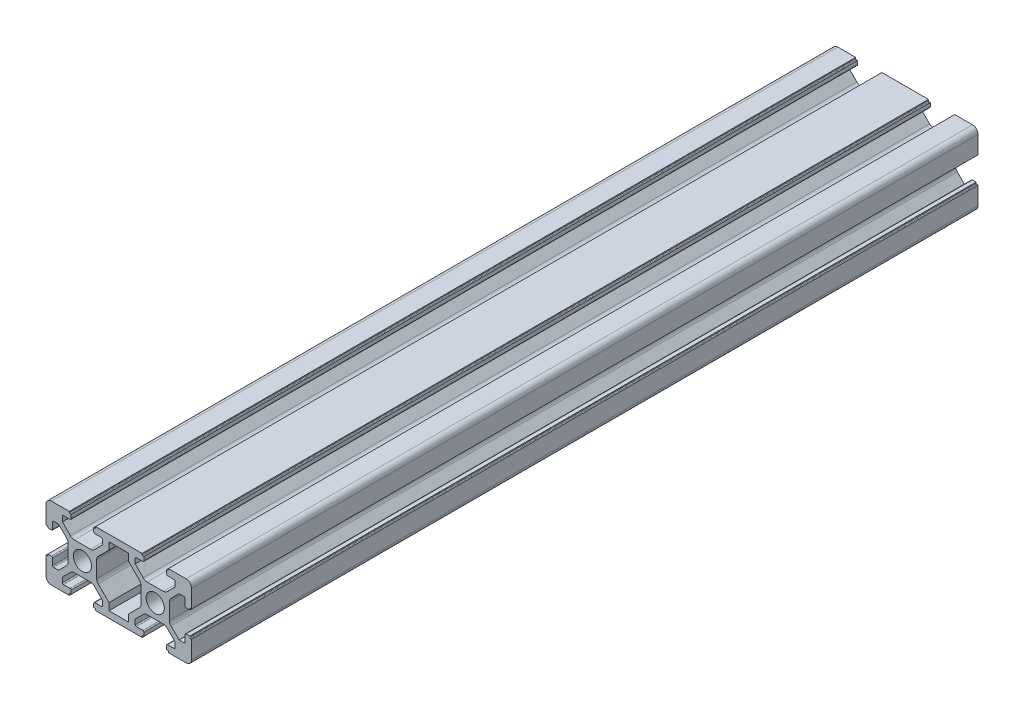
from build123d import *

# Parameters (mm, degrees)
SKETCH_1_R      = 2.5
EXTRUDE_1_DEPTH = 216


with BuildPart() as part:
    # 草图1 → 凸台-拉伸1 (new body)
    with BuildSketch(Plane.XY):
        with BuildLine():
            Line((-0.771587854, 9.545792426), (-5.671587854, 9.545792426))
            Line((-5.671587854, 9.545792426), (-5.671587854, 9.245792426))
            ThreePointArc((-5.671587854, 9.245792426), (-5.730166498, 9.10437107), (-5.871587854, 9.045792426))
            Line((-5.871587854, 9.045792426), (-6.171587854, 9.045792426))
            Line((-6.171587854, 9.045792426), (-6.171587854, 8.045792426))
            ThreePointArc((-6.171587854, 8.045792426), (-6.083719889, 7.833660392), (-5.871587854, 7.745792426))
            Line((-5.871587854, 7.745792426), (-4.071587854, 7.745792426))
            ThreePointArc((-4.071587854, 7.745792426), (-3.85945582, 7.657924461), (-3.771587854, 7.445792426))
            Line((-3.771587854, 7.445792426), (-3.771587854, 6.105792426))
            Line((-3.771587854, 6.105792426), (-5.992248026, 3.885132255))
            ThreePointArc((-5.992248026, 3.885132255), (-6.478883049, 3.559973128), (-7.052908198, 3.445792426))
            Line((-7.052908198, 3.445792426), (-11.490267511, 3.445792426))
            ThreePointArc((-11.490267511, 3.445792426), (-12.064292659, 3.559973128), (-12.550927682, 3.885132255))
            Line((-12.550927682, 3.885132255), (-14.771587854, 6.105792426))
            Line((-14.771587854, 6.105792426), (-14.771587854, 7.445792426))
            ThreePointArc((-14.771587854, 7.445792426), (-14.683719889, 7.657924461), (-14.471587854, 7.745792426))
            Line((-14.471587854, 7.745792426), (-12.671587854, 7.745792426))
            ThreePointArc((-12.671587854, 7.745792426), (-12.45945582, 7.833660392), (-12.371587854, 8.045792426))
            Line((-12.371587854, 8.045792426), (-12.371587854, 9.045792426))
            Line((-12.371587854, 9.045792426), (-12.671587854, 9.045792426))
            ThreePointArc((-12.671587854, 9.045792426), (-12.81300921, 9.10437107), (-12.871587854, 9.245792426))
            Line((-12.871587854, 9.245792426), (-12.871587854, 9.545792426))
            Line((-12.871587854, 9.545792426), (-17.771587854, 9.545792426))
            ThreePointArc((-17.771587854, 9.545792426), (-18.832248026, 9.106452598), (-19.271587854, 8.045792426))
            Line((-19.271587854, 8.045792426), (-19.271587854, 3.145792426))
            Line((-19.271587854, 3.145792426), (-18.971587854, 3.145792426))
            ThreePointArc((-18.971587854, 3.145792426), (-18.830166498, 3.087213783), (-18.771587854, 2.945792426))
            Line((-18.771587854, 2.945792426), (-18.771587854, 2.645792426))
            Line((-18.771587854, 2.645792426), (-17.771587854, 2.645792426))
            ThreePointArc((-17.771587854, 2.645792426), (-17.55945582, 2.733660392), (-17.471587854, 2.945792426))
            Line((-17.471587854, 2.945792426), (-17.471587854, 4.745792426))
            ThreePointArc((-17.471587854, 4.745792426), (-17.383719889, 4.957924461), (-17.171587854, 5.045792426))
            Line((-17.171587854, 5.045792426), (-15.831587854, 5.045792426))
            Line((-15.831587854, 5.045792426), (-13.610927682, 2.825132255))
            ThreePointArc((-13.610927682, 2.825132255), (-13.285768555, 2.338497231), (-13.171587854, 1.764472083))
            Line((-13.171587854, 1.764472083), (-13.171587854, -2.67288723))
            ThreePointArc((-13.171587854, -2.67288723), (-13.285768555, -3.246912379), (-13.610927682, -3.733547402))
            Line((-13.610927682, -3.733547402), (-15.831587854, -5.954207574))
            Line((-15.831587854, -5.954207574), (-17.171587854, -5.954207574))
            ThreePointArc((-17.171587854, -5.954207574), (-17.383719889, -5.866339608), (-17.471587854, -5.654207574))
            Line((-17.471587854, -5.654207574), (-17.471587854, -3.854207574))
            ThreePointArc((-17.471587854, -3.854207574), (-17.55945582, -3.642075539), (-17.771587854, -3.554207574))
            Line((-17.771587854, -3.554207574), (-18.771587854, -3.554207574))
            Line((-18.771587854, -3.554207574), (-18.771587854, -3.854207574))
            ThreePointArc((-18.771587854, -3.854207574), (-18.830166498, -3.99562893), (-18.971587854, -4.054207574))
            Line((-18.971587854, -4.054207574), (-19.271587854, -4.054207574))
            Line((-19.271587854, -4.054207574), (-19.271587854, -8.954207574))
            ThreePointArc((-19.271587854, -8.954207574), (-18.832248026, -10.014867745), (-17.771587854, -10.454207574))
            Line((-17.771587854, -10.454207574), (-12.871587854, -10.454207574))
            Line((-12.871587854, -10.454207574), (-12.871587854, -10.154207574))
            ThreePointArc((-12.871587854, -10.154207574), (-12.81300921, -10.012786217), (-12.671587854, -9.954207574))
            Line((-12.671587854, -9.954207574), (-12.371587854, -9.954207574))
            Line((-12.371587854, -9.954207574), (-12.371587854, -8.954207574))
            ThreePointArc((-12.371587854, -8.954207574), (-12.45945582, -8.742075539), (-12.671587854, -8.654207574))
            Line((-12.671587854, -8.654207574), (-14.471587854, -8.654207574))
            ThreePointArc((-14.471587854, -8.654207574), (-14.683719889, -8.566339608), (-14.771587854, -8.354207574))
            Line((-14.771587854, -8.354207574), (-14.771587854, -7.014207574))
            Line((-14.771587854, -7.014207574), (-12.550927682, -4.793547402))
            ThreePointArc((-12.550927682, -4.793547402), (-12.064292659, -4.468388275), (-11.490267511, -4.354207574))
            Line((-11.490267511, -4.354207574), (-7.052908198, -4.354207574))
            ThreePointArc((-7.052908198, -4.354207574), (-6.478883049, -4.468388275), (-5.992248026, -4.793547402))
            Line((-5.992248026, -4.793547402), (-3.771587854, -7.014207574))
            Line((-3.771587854, -7.014207574), (-3.771587854, -8.354207574))
            ThreePointArc((-3.771587854, -8.354207574), (-3.85945582, -8.566339608), (-4.071587854, -8.654207574))
            Line((-4.071587854, -8.654207574), (-5.871587854, -8.654207574))
            ThreePointArc((-5.871587854, -8.654207574), (-6.083719889, -8.742075539), (-6.171587854, -8.954207574))
            Line((-6.171587854, -8.954207574), (-6.171587854, -9.954207574))
            Line((-6.171587854, -9.954207574), (-5.871587854, -9.954207574))
            ThreePointArc((-5.871587854, -9.954207574), (-5.730166498, -10.012786217), (-5.671587854, -10.154207574))
            Line((-5.671587854, -10.154207574), (-5.671587854, -10.454207574))
            Line((-5.671587854, -10.454207574), (-0.771587854, -10.454207574))
            Line((-0.771587854, -10.454207574), (7.128412146, -10.454207574))
            Line((7.128412146, -10.454207574), (7.128412146, -10.154207574))
            ThreePointArc((7.128412146, -10.154207574), (7.18699079, -10.012786217), (7.328412146, -9.954207574))
            Line((7.328412146, -9.954207574), (7.628412146, -9.954207574))
            Line((7.628412146, -9.954207574), (7.628412146, -8.954207574))
            ThreePointArc((7.628412146, -8.954207574), (7.54054418, -8.742075539), (7.328412146, -8.654207574))
            Line((7.328412146, -8.654207574), (5.528412146, -8.654207574))
            ThreePointArc((5.528412146, -8.654207574), (5.316280111, -8.566339608), (5.228412146, -8.354207574))
            Line((5.228412146, -8.354207574), (5.228412146, -7.014207574))
            Line((5.228412146, -7.014207574), (7.449072318, -4.793547402))
            ThreePointArc((7.449072318, -4.793547402), (7.935707341, -4.468388275), (8.509732489, -4.354207574))
            Line((8.509732489, -4.354207574), (12.947091802, -4.354207574))
            ThreePointArc((12.947091802, -4.354207574), (13.521116951, -4.468388275), (14.007751974, -4.793547402))
            Line((14.007751974, -4.793547402), (16.228412146, -7.014207574))
            Line((16.228412146, -7.014207574), (16.228412146, -8.354207574))
            ThreePointArc((16.228412146, -8.354207574), (16.14054418, -8.566339608), (15.928412146, -8.654207574))
            Line((15.928412146, -8.654207574), (14.128412146, -8.654207574))
            ThreePointArc((14.128412146, -8.654207574), (13.916280111, -8.742075539), (13.828412146, -8.954207574))
            Line((13.828412146, -8.954207574), (13.828412146, -9.954207574))
            Line((13.828412146, -9.954207574), (14.128412146, -9.954207574))
            ThreePointArc((14.128412146, -9.954207574), (14.269833502, -10.012786217), (14.328412146, -10.154207574))
            Line((14.328412146, -10.154207574), (14.328412146, -10.454207574))
            Line((14.328412146, -10.454207574), (19.228412146, -10.454207574))
            ThreePointArc((19.228412146, -10.454207574), (20.289072318, -10.014867745), (20.728412146, -8.954207574))
            Line((20.728412146, -8.954207574), (20.728412146, -4.054207574))
            Line((20.728412146, -4.054207574), (20.428412146, -4.054207574))
            ThreePointArc((20.428412146, -4.054207574), (20.28699079, -3.99562893), (20.228412146, -3.854207574))
            Line((20.228412146, -3.854207574), (20.228412146, -3.554207574))
            Line((20.228412146, -3.554207574), (19.228412146, -3.554207574))
            ThreePointArc((19.228412146, -3.554207574), (19.016280111, -3.642075539), (18.928412146, -3.854207574))
            Line((18.928412146, -3.854207574), (18.928412146, -5.654207574))
            ThreePointArc((18.928412146, -5.654207574), (18.84054418, -5.866339608), (18.628412146, -5.954207574))
            Line((18.628412146, -5.954207574), (17.288412146, -5.954207574))
            Line((17.288412146, -5.954207574), (15.067751974, -3.733547402))
            ThreePointArc((15.067751974, -3.733547402), (14.742592847, -3.246912379), (14.628412146, -2.67288723))
            Line((14.628412146, -2.67288723), (14.628412146, 1.764472083))
            ThreePointArc((14.628412146, 1.764472083), (14.742592847, 2.338497231), (15.067751974, 2.825132255))
            Line((15.067751974, 2.825132255), (17.288412146, 5.045792426))
            Line((17.288412146, 5.045792426), (18.628412146, 5.045792426))
            ThreePointArc((18.628412146, 5.045792426), (18.84054418, 4.957924461), (18.928412146, 4.745792426))
            Line((18.928412146, 4.745792426), (18.928412146, 2.945792426))
            ThreePointArc((18.928412146, 2.945792426), (19.016280111, 2.733660392), (19.228412146, 2.645792426))
            Line((19.228412146, 2.645792426), (20.228412146, 2.645792426))
            Line((20.228412146, 2.645792426), (20.228412146, 2.945792426))
            ThreePointArc((20.228412146, 2.945792426), (20.28699079, 3.087213783), (20.428412146, 3.145792426))
            Line((20.428412146, 3.145792426), (20.728412146, 3.145792426))
            Line((20.728412146, 3.145792426), (20.728412146, 8.045792426))
            ThreePointArc((20.728412146, 8.045792426), (20.289072318, 9.106452598), (19.228412146, 9.545792426))
            Line((19.228412146, 9.545792426), (14.328412146, 9.545792426))
            Line((14.328412146, 9.545792426), (14.328412146, 9.245792426))
            ThreePointArc((14.328412146, 9.245792426), (14.269833502, 9.10437107), (14.128412146, 9.045792426))
            Line((14.128412146, 9.045792426), (13.828412146, 9.045792426))
            Line((13.828412146, 9.045792426), (13.828412146, 8.045792426))
            ThreePointArc((13.828412146, 8.045792426), (13.916280111, 7.833660392), (14.128412146, 7.745792426))
            Line((14.128412146, 7.745792426), (15.928412146, 7.745792426))
            ThreePointArc((15.928412146, 7.745792426), (16.14054418, 7.657924461), (16.228412146, 7.445792426))
            Line((16.228412146, 7.445792426), (16.228412146, 6.105792426))
            Line((16.228412146, 6.105792426), (14.007751974, 3.885132255))
            ThreePointArc((14.007751974, 3.885132255), (13.521116951, 3.559973128), (12.947091802, 3.445792426))
            Line((12.947091802, 3.445792426), (8.509732489, 3.445792426))
            ThreePointArc((8.509732489, 3.445792426), (7.935707341, 3.559973128), (7.449072318, 3.885132255))
            Line((7.449072318, 3.885132255), (5.228412146, 6.105792426))
            Line((5.228412146, 6.105792426), (5.228412146, 7.445792426))
            ThreePointArc((5.228412146, 7.445792426), (5.316280111, 7.657924461), (5.528412146, 7.745792426))
            Line((5.528412146, 7.745792426), (7.328412146, 7.745792426))
            ThreePointArc((7.328412146, 7.745792426), (7.54054418, 7.833660392), (7.628412146, 8.045792426))
            Line((7.628412146, 8.045792426), (7.628412146, 9.045792426))
            Line((7.628412146, 9.045792426), (7.328412146, 9.045792426))
            ThreePointArc((7.328412146, 9.045792426), (7.18699079, 9.10437107), (7.128412146, 9.245792426))
            Line((7.128412146, 9.245792426), (7.128412146, 9.545792426))
            Line((7.128412146, 9.545792426), (2.228412146, 9.545792426))
            Line((2.228412146, 9.545792426), (-0.771587854, 9.545792426))
        make_face()
        with Locations((10.728412146, -0.454207574)):
            Circle(SKETCH_1_R, mode=Mode.SUBTRACT)
        with Locations((-9.271587854, -0.454207574)):
            Circle(SKETCH_1_R, mode=Mode.SUBTRACT)
        with BuildLine():
            Line((-1.971587854, -6.694207574), (-4.932248026, -3.733547402))
            ThreePointArc((-4.932248026, -3.733547402), (-5.257407153, -3.246912379), (-5.371587854, -2.67288723))
            Line((-5.371587854, -2.67288723), (-5.371587854, 1.764472083))
            ThreePointArc((-5.371587854, 1.764472083), (-5.257407153, 2.338497231), (-4.932248026, 2.825132255))
            Line((-4.932248026, 2.825132255), (-1.971587854, 5.785792426))
            Line((-1.971587854, 5.785792426), (-1.971587854, 7.745792426))
            Line((-1.971587854, 7.745792426), (3.428412146, 7.745792426))
            Line((3.428412146, 7.745792426), (3.428412146, 5.785792426))
            Line((3.428412146, 5.785792426), (6.389072318, 2.825132255))
            ThreePointArc((6.389072318, 2.825132255), (6.714231445, 2.338497231), (6.828412146, 1.764472083))
            Line((6.828412146, 1.764472083), (6.828412146, -2.67288723))
            ThreePointArc((6.828412146, -2.67288723), (6.714231445, -3.246912379), (6.389072318, -3.733547402))
            Line((6.389072318, -3.733547402), (3.428412146, -6.694207574))
            Line((3.428412146, -6.694207574), (3.428412146, -8.654207574))
            Line((3.428412146, -8.654207574), (-1.971587854, -8.654207574))
            Line((-1.971587854, -8.654207574), (-1.971587854, -6.694207574))
        make_face(mode=Mode.SUBTRACT)
    extrude(amount=EXTRUDE_1_DEPTH)


solid = part.part
